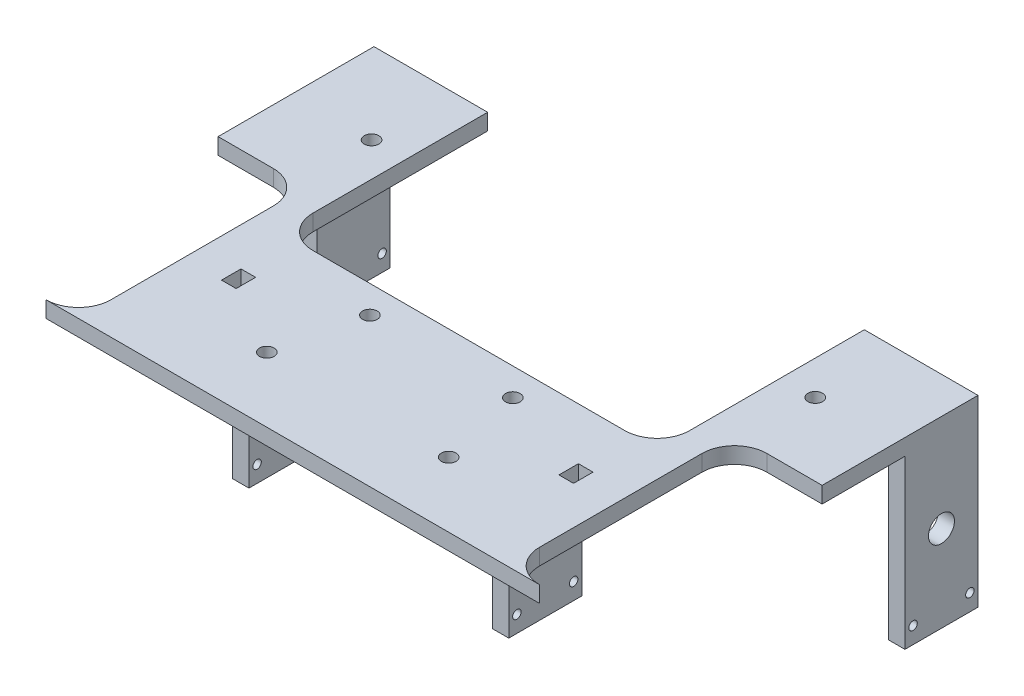
from build123d import *

# Parameters (mm, degrees)
BOSS_EXTRUDE1_DEPTH      = 5
SKETCH2_W                = 5
SKETCH2_H                = 22.5
BOSS_EXTRUDE2_DEPTH      = 38
SKETCH5_W                = 25
SKETCH5_H                = 5
BOSS_EXTRUDE3_DEPTH      = 30
FILLET3_R                = 5
SKETCH6_R                = 3
CUT_EXTRUDE4_DEPTH       = 172
SKETCH7_W                = 5
SKETCH7_H                = 22.5
BOSS_EXTRUDE4_DEPTH      = 51.5
SKETCH3_R                = 1.3
CUT_EXTRUDE2_DEPTH       = 357.71872673
SKETCH9_W                = 116
SKETCH9_H                = 63.779574991
CUT_EXTRUDE6_DEPTH       = 10
SKETCH10_W               = 25
SKETCH10_H               = 5
BOSS_EXTRUDE5_DEPTH      = 70
BOSS_EXTRUDE6_DEPTH      = 25
SKETCH12_W               = 25
SKETCH12_H               = 5
BOSS_EXTRUDE7_DEPTH      = 19.72
BOSS_EXTRUDE8_DEPTH      = 15
BOSS_EXTRUDE8_DEPTH_BACK = 4
CUT_EXTRUDE7_DEPTH       = 15
SKETCH15_R               = 2.25
CUT_EXTRUDE8_DEPTH       = 20
SKETCH16_W               = 6
SKETCH16_H               = 3
BOSS_EXTRUDE9_DEPTH      = 12.4
SKETCH17_R               = 1
CUT_EXTRUDE9_DEPTH       = 282.347152812
SKETCH27_W               = 25.232191294
SKETCH27_H               = 19
BOSS_EXTRUDE11_DEPTH     = 3
FILLET4_R                = 5
SKETCH18_R               = 2.25
CUT_EXTRUDE10_DEPTH      = 378.078044336
SKETCH19_W               = 4.5
SKETCH19_H               = 6
CUT_EXTRUDE12_DEPTH      = 383.13686347
FILLET6_R                = 10
SKETCH21_W               = 27
SKETCH21_H               = 70
CUT_EXTRUDE14_DEPTH      = 383.13686347
FILLET7_R                = 10
SKETCH22_R               = 2.25
CUT_EXTRUDE16_DEPTH      = 10
SKETCH23_W               = 17.043474802
SKETCH23_H               = 5.138762975
BOSS_EXTRUDE10_DEPTH     = 7
CUT_EXTRUDE17_REACH      = 372.436
CUT_EXTRUDE18_REACH      = 380.086
SKETCH25_R               = 2.25
SKETCH28_R               = 2.25
CUT_EXTRUDE19_DEPTH      = 384.936136276
SKETCH30_W               = 438.94108036
SKETCH30_H               = 213.926961157
CUT_EXTRUDE22_DEPTH      = 384.936136276
SKETCH31_W               = 83.134099451
SKETCH31_H               = 28.659633058
CUT_EXTRUDE23_DEPTH      = 253.735705209
SKETCH32_R               = 2.25
CUT_EXTRUDE24_DEPTH      = 227.212842253
CUT_EXTRUDE26_DEPTH      = 110
CUT_EXTRUDE26_DEPTH_BACK = 10
SKETCH33_R               = 4
SKETCH34_R               = 4
CUT_EXTRUDE27_DEPTH      = 227.212842253


with BuildPart() as part:
    # Sketch1 → Boss-Extrude1 (new body)
    with BuildSketch(Plane(origin=(0, 0, 0), x_dir=(1, 0, 0), z_dir=(0, 1, 0))):
        Polygon((0, 0), (0, -300), (186, -300), (186, 0), (176, 0), (151, 0), (151, -56.115865257), (35, -56.115865257), (35, 0), (10, 0), align=None)
    extrude(amount=BOSS_EXTRUDE1_DEPTH)

    # Sketch2 → Boss-Extrude2 (add)
    with BuildSketch(Plane.XZ):
        with Locations((53, 82.75)):
            Rectangle(SKETCH2_W, SKETCH2_H)
        with Locations((133, 82.75)):
            Rectangle(SKETCH2_W, SKETCH2_H)
    extrude(amount=BOSS_EXTRUDE2_DEPTH)

    # Sketch5 → Boss-Extrude3 (add)
    with BuildSketch(Plane.XZ):
        with Locations((173.5, 297.5)):
            Rectangle(SKETCH5_W, SKETCH5_H)
        with Locations((173.5, 242.5)):
            Rectangle(SKETCH5_W, SKETCH5_H)
        with Locations((173.5, 187.5)):
            Rectangle(SKETCH5_W, SKETCH5_H)
        with Locations((173.5, 132.5)):
            Rectangle(SKETCH5_W, SKETCH5_H)
    extrude(amount=BOSS_EXTRUDE3_DEPTH)

    # Fillet3
    fillet3_edges = [part.edges().sort_by_distance(p)[0] for p in [
        (173.5, 0, 295),
        (173.5, 0, 240),
        (173.5, 0, 185),
        (173.5, 0, 130),
    ]]
    fillet(fillet3_edges, radius=FILLET3_R)

    # Sketch6 → Cut-Extrude4 (cut)
    with BuildSketch(Plane.XY.offset(300)):
        with Locations((178, -24)):
            Circle(SKETCH6_R)
    extrude(amount=-CUT_EXTRUDE4_DEPTH, mode=Mode.SUBTRACT)

    # Sketch7 → Boss-Extrude4 (add)
    with BuildSketch(Plane.XZ):
        with Locations((2.5, 11.25)):
            Rectangle(SKETCH7_W, SKETCH7_H)
        with Locations((183.5, 11.25)):
            Rectangle(SKETCH7_W, SKETCH7_H)
    extrude(amount=BOSS_EXTRUDE4_DEPTH)

    # Sketch3 → Cut-Extrude2 (cut, through all)
    with BuildSketch(Plane(origin=(186, 0, 0), x_dir=(0, 0, -1), z_dir=(1, 0, 0))):
        with Locations((-74, -32.9)):
            Circle(SKETCH3_R)
        with Locations((-91.5, -32.9)):
            Circle(SKETCH3_R)
        with Locations((-20, -46.4)):
            Circle(SKETCH3_R)
        with Locations((-2.5, -46.4)):
            Circle(SKETCH3_R)
    extrude(amount=-CUT_EXTRUDE2_DEPTH, mode=Mode.SUBTRACT)

    # Sketch9 → Cut-Extrude6 (cut)
    with BuildSketch(Plane.XZ):
        with Locations((93, 31.889787496)):
            Rectangle(SKETCH9_W, SKETCH9_H)
    extrude(amount=-CUT_EXTRUDE6_DEPTH, mode=Mode.SUBTRACT)

    # Sketch10 → Boss-Extrude5 (add)
    with BuildSketch(Plane.XZ.offset(30)):
        with Locations((173.5, 297.5)):
            Rectangle(SKETCH10_W, SKETCH10_H)
        with Locations((173.5, 132.5)):
            Rectangle(SKETCH10_W, SKETCH10_H)
    extrude(amount=BOSS_EXTRUDE5_DEPTH)

    # Sketch11 → Boss-Extrude6 (add)
    with BuildSketch(Plane(origin=(186, 0, 0), x_dir=(0, 0, -1), z_dir=(1, 0, 0))):
        Polygon((-300, -100), (-304.901863346, -134.643852153), (-300, -135.337431613), (-295, -100), align=None)
    extrude(amount=-BOSS_EXTRUDE6_DEPTH)

    # Sketch12 → Boss-Extrude7 (add)
    with BuildSketch(Plane.XZ.offset(100)):
        with Locations((173.5, 132.5)):
            Rectangle(SKETCH12_W, SKETCH12_H)
    extrude(amount=BOSS_EXTRUDE7_DEPTH)

    # Sketch13 → Boss-Extrude8 (add, two sides: drawn at the far end of the back side and taken through both)
    with BuildSketch(Plane(origin=(0, 0, 130), x_dir=(-1, 0, 0), z_dir=(0, 0, -1)).offset(-BOSS_EXTRUDE8_DEPTH_BACK)):
        Polygon((-186, -115.314128401), (-186, -119.72), (-161, -123.135183378), (-161, -115.314128401), align=None)
    extrude(amount=BOSS_EXTRUDE8_DEPTH + BOSS_EXTRUDE8_DEPTH_BACK)

    # Sketch14 → Cut-Extrude7 (cut)
    with BuildSketch(Plane(origin=(19.462480736, -142.470246704, 0), x_dir=(0.9907978149243062, 0.13535024913615948, 0), z_dir=(0.13535024913615948, -0.9907978149243062, 0))):
        Polygon((186.357631366, 115), (168.084261749, 132.037436989), (198.015187573, 130.430954629), (197.515117956, 111.366582762), (186.357631366, 109.607523038), align=None)
    extrude(amount=-CUT_EXTRUDE7_DEPTH, mode=Mode.SUBTRACT)

    # Sketch15 → Cut-Extrude8 (cut)
    with BuildSketch(Plane(origin=(0, 39.65203451, 280.240211564), x_dir=(1, 0, 0), z_dir=(0, 0.14009757598944012, 0.9901377021414158))):
        with Locations(Location((178, -168.031966348, 0), (0, 0, 270))):
            Circle(SKETCH15_R)
        with Locations(Location((169, -149.043043011, 0), (0, 0, 270))):
            Circle(SKETCH15_R)
    extrude(amount=-CUT_EXTRUDE8_DEPTH, mode=Mode.SUBTRACT)

    # Sketch16 → Boss-Extrude9 (add)
    with BuildSketch(Plane.XZ):
        with Locations((169, 273.5)):
            Rectangle(SKETCH16_W, SKETCH16_H)
        with Locations((140.4, 273.5)):
            Rectangle(SKETCH16_W, SKETCH16_H)
        with Locations((169, 218.5)):
            Rectangle(SKETCH16_W, SKETCH16_H)
        with Locations((169, 163.5)):
            Rectangle(SKETCH16_W, SKETCH16_H)
        with Locations((140.4, 218.5)):
            Rectangle(SKETCH16_W, SKETCH16_H)
        with Locations((140.4, 163.5)):
            Rectangle(SKETCH16_W, SKETCH16_H)
    extrude(amount=BOSS_EXTRUDE9_DEPTH)

    # Sketch17 → Cut-Extrude9 (cut, through all)
    with BuildSketch(Plane(origin=(0, 0, 162), x_dir=(-1, 0, 0), z_dir=(0, 0, -1))):
        with BuildLine():
            ThreePointArc((-169.75, -5.6), (-169.95, -6.2), (-169.75, -6.8))
            ThreePointArc((-169.75, -6.8), (-168.633772234, -7.148683298), (-167.95, -6.2))
            ThreePointArc((-167.95, -6.2), (-168.633772234, -5.251316702), (-169.75, -5.6))
        make_face()
        with Locations((-140.45, -6.2)):
            Circle(SKETCH17_R)
    extrude(amount=-CUT_EXTRUDE9_DEPTH, mode=Mode.SUBTRACT)

    # Sketch27 → Boss-Extrude11 (add)
    with BuildSketch(Plane(origin=(19.462480736, -142.470246704, 0), x_dir=(0.9907978149243062, 0.13535024913615953, 0), z_dir=(0.13535024913615953, -0.9907978149243062, 0))):
        with Locations((155.468166102, 124.5)):
            Rectangle(SKETCH27_W, SKETCH27_H)
    extrude(amount=BOSS_EXTRUDE11_DEPTH)

    # Fillet4
    fillet4_edges = [part.edges().sort_by_distance(p)[0] for p in [
        (140.4, 0, 220),
        (169, 0, 165),
        (169, 0, 220),
        (140.4, 0, 275),
        (140.4, 0, 165),
        (169, 0, 275),
    ]]
    fillet(fillet4_edges, radius=FILLET4_R)

    # Sketch18 → Cut-Extrude10 (cut, through all)
    with BuildSketch(Plane(origin=(0, -115.314128401, 0), x_dir=(1, 0, 0), z_dir=(0, 1, 0))):
        with Locations(Location((174.885718372, -120.99470656, 0), (0, 0, 180))):
            Circle(SKETCH18_R)
    extrude(amount=-CUT_EXTRUDE10_DEPTH, mode=Mode.SUBTRACT)

    # Sketch19 → Cut-Extrude12 (cut, through all)
    with BuildSketch(Plane.XZ):
        with Locations((144.95, 82.75)):
            Rectangle(SKETCH19_W, SKETCH19_H)
        with Locations((41.05, 82.75)):
            Rectangle(SKETCH19_W, SKETCH19_H)
    extrude(amount=-CUT_EXTRUDE12_DEPTH, mode=Mode.SUBTRACT)

    # Fillet6
    fillet6_edges = [part.edges().sort_by_distance(p)[0] for p in [
        (35, 2.5, 63.779574991),
        (151, 2.5, 63.779574991),
    ]]
    fillet(fillet6_edges, radius=FILLET6_R)

    # Sketch21 → Cut-Extrude14 (cut, through all)
    with BuildSketch(Plane.XZ):
        with Locations((13.5, 83)):
            Rectangle(SKETCH21_W, SKETCH21_H)
        with Locations((172.5, 83)):
            Rectangle(SKETCH21_W, SKETCH21_H)
    extrude(amount=-CUT_EXTRUDE14_DEPTH, mode=Mode.SUBTRACT)

    # Fillet7
    fillet7_edges = [part.edges().sort_by_distance(p)[0] for p in [
        (27, 2.5, 118),
        (27, 2.5, 48),
        (159, 2.5, 48),
        (159, 2.5, 118),
    ]]
    fillet(fillet7_edges, radius=FILLET7_R)

    # Sketch22 → Cut-Extrude16 (cut)
    with BuildSketch(Plane.XZ):
        with Locations(Location((24.5, 25.25, 0), (0, 0, 270))):
            Circle(SKETCH22_R)
        with Locations(Location((161.5, 25.617459027, 0), (0, 0, 270))):
            Circle(SKETCH22_R)
        with Locations(Location((115, 72.25, 0), (0, 0, 270))):
            Circle(SKETCH22_R)
        with Locations(Location((71, 72.25, 0), (0, 0, 270))):
            Circle(SKETCH22_R)
    extrude(amount=-CUT_EXTRUDE16_DEPTH, mode=Mode.SUBTRACT)

    # Sketch23 → Boss-Extrude10 (add)
    with BuildSketch(Plane.XY.offset(135)):
        with Locations((169.584553608, -121.006176699)):
            Rectangle(SKETCH23_W, SKETCH23_H)
    extrude(amount=BOSS_EXTRUDE10_DEPTH)

    # Sketch24 → Cut-Extrude17 (cut, up to next)
    with BuildSketch(Plane.ZY.offset(-161.062816207), mode=Mode.PRIVATE) as cut_extrude17_sk1:
        Polygon((142, -121.648432415), (135, -122.638883571), (134.714975443, -124.33810847), (142, -124.33810847), align=None)
    cut_extrude17_tool1 = extrude(cut_extrude17_sk1.sketch, amount=-CUT_EXTRUDE17_REACH, mode=Mode.PRIVATE) & part.part
    add(cut_extrude17_tool1.solids().sort_by_distance((161.062816, -123.230784, 138.703404))[0], mode=Mode.SUBTRACT)

    # Cut-Extrude18: up to this plane
    cut_extrude18_end = Plane(origin=(186.407050747, -121.648432415, 142), z_dir=(0, 0.9901377021414159, -0.14009757598943937))
    # Sketch25 → Cut-Extrude18 (cut, up to the surface)
    with BuildSketch(Plane(origin=(0, -118.436795211, 0), x_dir=(1, 0, 0), z_dir=(0, 1, 0)), mode=Mode.PRIVATE) as cut_extrude18_sk1:
        with Locations(Location((174.719138996, -138.089405518, 0), (0, 0, 270))):
            Circle(SKETCH25_R)
    cut_extrude18_tool1 = split(extrude(cut_extrude18_sk1.sketch, amount=-CUT_EXTRUDE18_REACH, mode=Mode.PRIVATE), bisect_by=cut_extrude18_end, keep=Keep.BOTH, mode=Mode.PRIVATE)
    add(cut_extrude18_tool1.solids().sort_by_distance((174.719139, -118.436795, 138.089406))[0], mode=Mode.SUBTRACT)

    # Sketch28 → Cut-Extrude19 (cut, through all)
    with BuildSketch(Plane(origin=(0, 5, 0), x_dir=(1, 0, 0), z_dir=(0, 1, 0))):
        with Locations(Location((93, -260, 0), (0, 0, 270))):
            Circle(SKETCH28_R)
    extrude(amount=-CUT_EXTRUDE19_DEPTH, mode=Mode.SUBTRACT)

    # Sketch30 → Cut-Extrude22 (cut, through all)
    with BuildSketch(Plane(origin=(0, 5, 0), x_dir=(1, 0, 0), z_dir=(0, 1, 0))):
        with Locations((159.951638518, -224.963480578)):
            Rectangle(SKETCH30_W, SKETCH30_H)
    extrude(amount=-CUT_EXTRUDE22_DEPTH, mode=Mode.SUBTRACT)


with BuildPart() as cut_extrude22_piece_1:
    # of the separate pieces the step leaves, piece 1, a body of its own (cut_extrude22_pieces)
    add(part.part.solids().sort_by_distance((169, 0, 48))[0])

    # Sketch32 → Cut-Extrude24 (cut, through all)
    with BuildSketch(Plane.XZ):
        with Locations(Location((121, 98, 0), (0, 0, 270))):
            Circle(SKETCH32_R)
        with Locations(Location((65, 98, 0), (0, 0, 270))):
            Circle(SKETCH32_R)
    extrude(amount=-CUT_EXTRUDE24_DEPTH, mode=Mode.SUBTRACT)

    # Sketch33 → Cut-Extrude26 (cut, two sides: drawn at the far end of the back side and taken through both)
    with BuildSketch(Plane(origin=(55.5, 0, 0), x_dir=(0, 0, -1), z_dir=(1, 0, 0)).offset(-CUT_EXTRUDE26_DEPTH_BACK)):
        with Locations(Location((-82.75, -11.4, 0), (0, 0, 180))):
            Circle(SKETCH33_R)
    extrude(amount=CUT_EXTRUDE26_DEPTH + CUT_EXTRUDE26_DEPTH_BACK, mode=Mode.SUBTRACT)

    # Sketch34 → Cut-Extrude27 (cut, through all)
    with BuildSketch(Plane(origin=(186, 0, 0), x_dir=(0, 0, -1), z_dir=(1, 0, 0))):
        with Locations((-11.25, -24.9)):
            Circle(SKETCH34_R)
    extrude(amount=-CUT_EXTRUDE27_DEPTH, mode=Mode.SUBTRACT)


with BuildPart() as cut_extrude22_piece_2:
    # of the separate pieces the step leaves, piece 2, a body of its own (cut_extrude22_pieces)
    add(part.part.solids().sort_by_distance((186, -115.314128401, 118))[0])

    # Sketch31 → Cut-Extrude23 (cut, through all)
    with BuildSketch(Plane(origin=(0, 0, 115), x_dir=(-1, 0, 0), z_dir=(0, 0, -1))):
        with Locations((-171.317335901, -127.032941637)):
            Rectangle(SKETCH31_W, SKETCH31_H)
    extrude(amount=-CUT_EXTRUDE23_DEPTH, mode=Mode.SUBTRACT)


solid = cut_extrude22_piece_1.part
